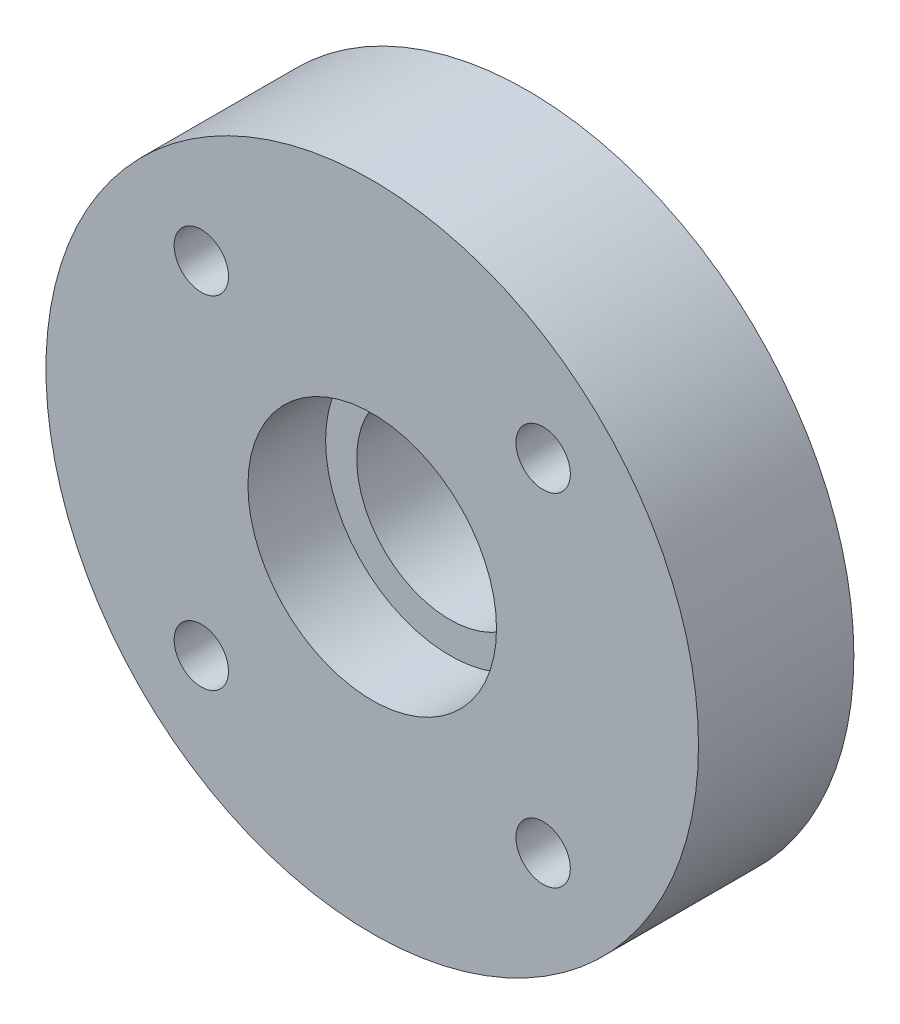
from build123d import *

# Parameters (mm, degrees)
SKETCH1_R           = 21
BOSS_EXTRUDE1_DEPTH = 10
SKETCH2_R           = 6
CUT_EXTRUDE1_DEPTH  = 32.336879232
SKETCH3_R           = 8
CUT_EXTRUDE2_DEPTH  = 5
SKETCH4_R           = 1.75
CUT_EXTRUDE3_DEPTH  = 32.336879232


with BuildPart() as part:
    # Sketch1 → Boss-Extrude1 (new body)
    with BuildSketch(Plane.XY):
        Circle(SKETCH1_R)
    extrude(amount=BOSS_EXTRUDE1_DEPTH)

    # Sketch2 → Cut-Extrude1 (cut, through all)
    with BuildSketch(Plane.XY.offset(10)):
        Circle(SKETCH2_R)
    extrude(amount=-CUT_EXTRUDE1_DEPTH, mode=Mode.SUBTRACT)

    # Sketch3 → Cut-Extrude2 (cut)
    with BuildSketch(Plane.XY.offset(10)):
        Circle(SKETCH3_R)
    extrude(amount=-CUT_EXTRUDE2_DEPTH, mode=Mode.SUBTRACT)

    # Sketch4 → Cut-Extrude3 (cut, through all)
    with BuildSketch(Plane.XY.offset(10)):
        with Locations((-11, 11)):
            Circle(SKETCH4_R)
        with Locations(Location((11, 11, 0), (0, 0, 180))):
            Circle(SKETCH4_R)
        with Locations((11, -11)):
            Circle(SKETCH4_R)
        with Locations(Location((-11, -11, 0), (0, 0, 180))):
            Circle(SKETCH4_R)
    extrude(amount=-CUT_EXTRUDE3_DEPTH, mode=Mode.SUBTRACT)


solid = part.part
